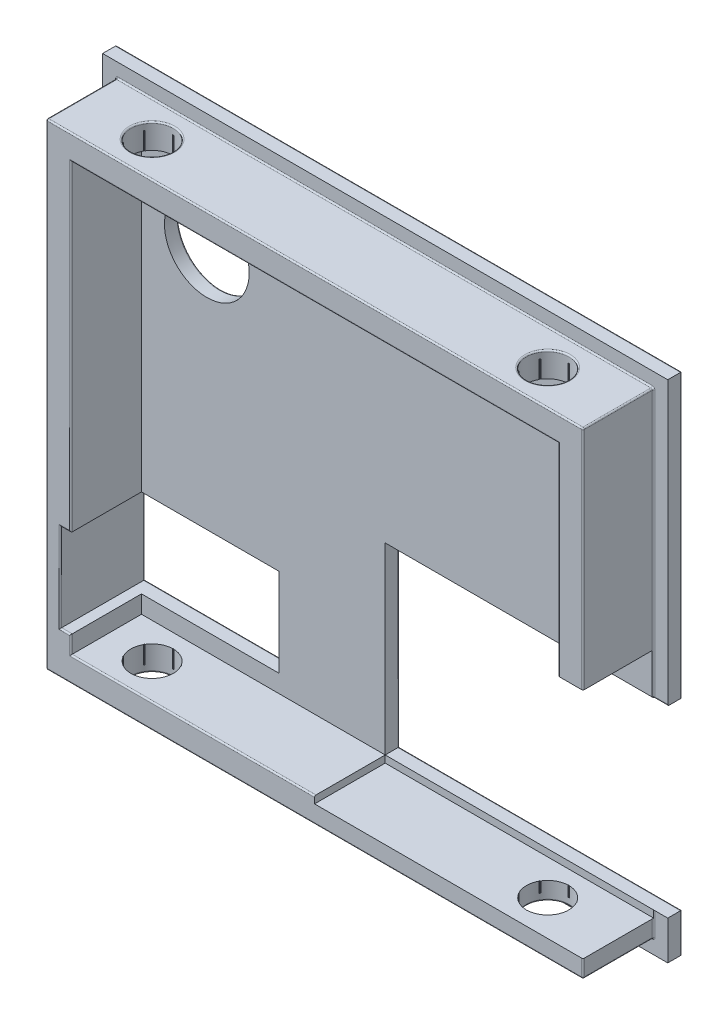
from build123d import *

# Parameters (mm, degrees)
ESQUISSE1_W               = 80
ESQUISSE1_H               = 71.5
BOSS_EXTRU_1_DEPTH        = 2
ESQUISSE2_W               = 76
ESQUISSE2_H               = 67.5
ESQUISSE2_W_2             = 69
ESQUISSE2_H_2             = 60.5
BOSS_EXTRU_2_DEPTH        = 10
ENL_V_MAT_EXTRU_1_DEPTH   = 2.5
ESQUISSE5_R               = 3
ENL_V_MAT_EXTRU_2_DEPTH   = 21
SYM_TRIE2_COPY_1_DEPTH    = 2.5
SYM_TRIE2_COPY_2_SKETCH_R = 3
SYM_TRIE2_COPY_2_DEPTH    = 21
ESQUISSE7_W               = 40
ESQUISSE7_H               = 26
ENL_V_MAT_EXTRU_3_DEPTH   = 15
ESQUISSE8_R               = 2.5
ENL_V_MAT_EXTRU_4_DEPTH   = 5
ESQUISSE10_R              = 6
ENL_V_MAT_EXTRU_5_DEPTH   = 5
ENL_V_MAT_EXTRU_5_DRAFT   = 1
ESQUISSE11_W              = 21
ESQUISSE11_H              = 12.5
ENL_V_MAT_EXTRU_6_DEPTH   = 15
CONG_1_R                  = 0.2
ESQUISSE12_W              = 10
ESQUISSE12_H              = 6.429100258
ENL_V_MAT_EXTRU_7_DEPTH   = 10
ESQUISSE13_W              = 38.038929767
ESQUISSE13_H              = 10
ENL_V_MAT_EXTRU_8_DEPTH   = 1


with BuildPart() as part:
    # Esquisse1 → Boss.-Extru.1 (new body)
    with BuildSketch(Plane.XY):
        Rectangle(ESQUISSE1_W, ESQUISSE1_H)
    extrude(amount=BOSS_EXTRU_1_DEPTH)

    # Esquisse2 → Boss.-Extru.2 (add)
    with BuildSketch(Plane.XY.offset(2)):
        Rectangle(ESQUISSE2_W, ESQUISSE2_H)
        Rectangle(ESQUISSE2_W_2, ESQUISSE2_H_2, mode=Mode.SUBTRACT)
    extrude(amount=BOSS_EXTRU_2_DEPTH)

    # Esquisse4 → Enlèv. mat.-Extru.1 (cut)
    with BuildSketch(Plane.XZ.offset(-30.25)):
        Polygon((-25.356874201, 5.473990608), (-25.356874201, 8.526009392), (-28, 10.052018783), (-30.643125799, 8.526009392), (-30.643125799, 5.473990608), (-28, 3.947981217), align=None)
    enl_v_mat_extru_1 = extrude(amount=-ENL_V_MAT_EXTRU_1_DEPTH, mode=Mode.SUBTRACT)

    # Esquisse5 → Enlèv. mat.-Extru.2 (cut)
    with BuildSketch(Plane.XZ.offset(-30.25)):
        with Locations(Location((-28, 7, 0), (0, 0, 270))):
            Circle(ESQUISSE5_R)
    enl_v_mat_extru_2 = extrude(amount=-ENL_V_MAT_EXTRU_2_DEPTH, mode=Mode.SUBTRACT)

    # Symétrie1: Enlèv. mat.-Extru.1, Enlèv. mat.-Extru.2 across plane
    add(enl_v_mat_extru_1.mirror(Plane(origin=(0, 0, 0), x_dir=(0, 0, 1), z_dir=(1, 0, 0))), mode=Mode.SUBTRACT)
    add(enl_v_mat_extru_2.mirror(Plane(origin=(0, 0, 0), x_dir=(0, 0, 1), z_dir=(1, 0, 0))), mode=Mode.SUBTRACT)

    # Symétrie2: Enlèv. mat.-Extru.1, Enlèv. mat.-Extru.2 across plane
    add(enl_v_mat_extru_1.mirror(Plane.ZX), mode=Mode.SUBTRACT)
    add(enl_v_mat_extru_2.mirror(Plane.ZX), mode=Mode.SUBTRACT)

    # Symétrie2 copy 1 sketch → Symétrie2 copy 1 (cut)
    with BuildSketch(Plane(origin=(0, -30.25, 0), x_dir=(-1, 0, 0), z_dir=(0, 1, 0))):
        Polygon((-25.356874201, 5.473990608), (-25.356874201, 8.526009392), (-28, 10.052018783), (-30.643125799, 8.526009392), (-30.643125799, 5.473990608), (-28, 3.947981217), align=None)
    extrude(amount=-SYM_TRIE2_COPY_1_DEPTH, mode=Mode.SUBTRACT)

    # Symétrie2 copy 2 sketch → Symétrie2 copy 2 (cut)
    with BuildSketch(Plane(origin=(0, -30.25, 0), x_dir=(-1, 0, 0), z_dir=(0, 1, 0))):
        with Locations(Location((-28, 7, 0), (0, 0, 270))):
            Circle(SYM_TRIE2_COPY_2_SKETCH_R)
    extrude(amount=-SYM_TRIE2_COPY_2_DEPTH, mode=Mode.SUBTRACT)

    # Esquisse7 → Enlèv. mat.-Extru.3 (cut)
    with BuildSketch(Plane(origin=(0, 0, 0), x_dir=(-1, 0, 0), z_dir=(0, 0, -1))):
        with Locations((-20, -17.25)):
            Rectangle(ESQUISSE7_W, ESQUISSE7_H)
    extrude(amount=-ENL_V_MAT_EXTRU_3_DEPTH, mode=Mode.SUBTRACT)

    # Esquisse8 → Enlèv. mat.-Extru.4 (cut)
    with BuildSketch(Plane(origin=(0, 0, 0), x_dir=(-1, 0, 0), z_dir=(0, 0, -1))):
        with Locations((0, 27.75)):
            Circle(ESQUISSE8_R)
    extrude(amount=-ENL_V_MAT_EXTRU_4_DEPTH, mode=Mode.SUBTRACT)


with BuildPart() as enl_v_mat_extru_5_tool:
    # Esquisse10 → Enlèv. mat.-Extru.5 (with draft: the straight prism first)
    with BuildSketch(Plane.XY.offset(2)):
        with Locations((-25.252427527, 19.212671665)):
            Circle(ESQUISSE10_R)
    extrude(amount=-ENL_V_MAT_EXTRU_5_DEPTH)
    # Enlèv. mat.-Extru.5: the draft: its side faces are tilted about the plane it starts from
    enl_v_mat_extru_5_sides = [enl_v_mat_extru_5_tool.faces().sort_by_distance(p)[0] for p in [
        (-31.252427527, 19.212671665, -0.5),
    ]]
    draft(enl_v_mat_extru_5_sides, Plane.XY.offset(2), ENL_V_MAT_EXTRU_5_DRAFT)


with BuildPart() as part_1:
    add(part.part)

    # Enlèv. mat.-Extru.5: cut by enl_v_mat_extru_5_tool
    add(enl_v_mat_extru_5_tool.part, mode=Mode.SUBTRACT)

    # Esquisse11 → Enlèv. mat.-Extru.6 (cut)
    with BuildSketch(Plane(origin=(0, 0, 0), x_dir=(-1, 0, 0), z_dir=(0, 0, -1))):
        with Locations((25.5, -21.5)):
            Rectangle(ESQUISSE11_W, ESQUISSE11_H)
    extrude(amount=-ENL_V_MAT_EXTRU_6_DEPTH, mode=Mode.SUBTRACT)

    # Congé1
    cong_1_edges = [part_1.edges().sort_by_distance(p)[0] for p in [
        (28, 33.75, 10),
        (38, -32, 12),
        (0, 33.75, 12),
        (-38, 0, 12),
        (0, -33.75, 12),
        (-28, -33.75, 10),
        (38, -32, 2),
        (38, -33.75, 7),
        (0, 33.75, 2),
        (38, 33.75, 7),
        (-38, 0, 2),
        (-38, 33.75, 7),
        (0, -33.75, 2),
        (-38, -33.75, 7),
        (0, 30.25, 12),
        (-34.5, 7.5, 12),
        (1.75, -30.25, 12),
        (28, -33.75, 10),
        (34.5, 13, 12),
        (38, 14.75, 2),
        (38, 14.75, 12),
        (40, 15.75, 0),
        (39, -4.25, 2),
        (36.25, -4.25, 12),
        (38, -4.25, 7),
        (20, -30.25, 0),
        (0, -17.25, 0),
        (20, -4.25, 0),
        (2.5, 27.75, 0),
        (-31.287337657, 19.212671665, 0),
        (-34.5, -29, 12),
        (-36, -21.5, 12),
        (-35.25, -27.75, 12),
        (-35.25, -15.25, 12),
        (-25.5, -15.25, 0),
        (-36, -21.5, 0),
        (-15, -21.5, 0),
        (-25.5, -27.75, 0),
        (0, -35.75, 0),
        (-40, 0, 0),
        (0, 35.75, 0),
        (40, -33, 0),
        (-28, 33.75, 10),
    ]]
    fillet(cong_1_edges, radius=CONG_1_R)

    # Esquisse12 → Enlèv. mat.-Extru.7 (cut)
    with BuildSketch(Plane(origin=(38, 0, 0), x_dir=(0, 0, -1), z_dir=(1, 0, 0))):
        with Locations((-7, -1.557866838)):
            Rectangle(ESQUISSE12_W, ESQUISSE12_H)
    extrude(amount=-ENL_V_MAT_EXTRU_7_DEPTH, mode=Mode.SUBTRACT)

    # Esquisse13 → Enlèv. mat.-Extru.8 (cut)
    with BuildSketch(Plane(origin=(0, -30.25, 0), x_dir=(1, 0, 0), z_dir=(0, 1, 0))):
        with Locations((19.019464883, -7)):
            Rectangle(ESQUISSE13_W, ESQUISSE13_H)
    extrude(amount=-ENL_V_MAT_EXTRU_8_DEPTH, mode=Mode.SUBTRACT)


solid = part_1.part
